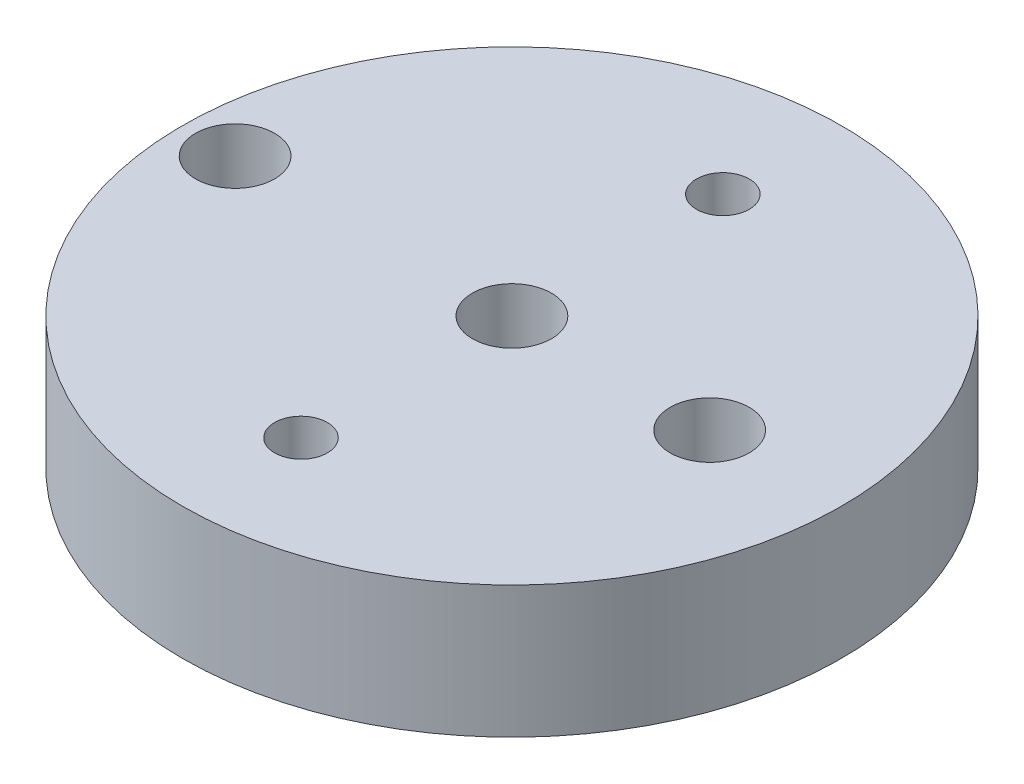
from build123d import *

# Parameters (mm, degrees)
SKETCH1_R           = 12.5
SKETCH1_R_2         = 1
SKETCH1_R_3         = 1.5
BOSS_EXTRUDE1_DEPTH = 5


with BuildPart() as part:
    # Sketch1 → Boss-Extrude1 (new body)
    with BuildSketch(Plane(origin=(0, 0, 0), x_dir=(1, 0, 0), z_dir=(0, 1, 0))):
        with Locations(Location((0, 0, 0), (0, 0, 270))):
            Circle(SKETCH1_R)
        with Locations(Location((0, -8, 0), (0, 0, 270))):
            Circle(SKETCH1_R_2, mode=Mode.SUBTRACT)
        with Locations(Location((0, 8, 0), (0, 0, 270))):
            Circle(SKETCH1_R_2, mode=Mode.SUBTRACT)
        with Locations(Location((0, 0, 0), (0, 0, 270))):
            Circle(SKETCH1_R_3, mode=Mode.SUBTRACT)
        with Locations(Location((-10.5, 0, 0), (0, 0, 270))):
            Circle(SKETCH1_R_3, mode=Mode.SUBTRACT)
        with Locations(Location((7.5, 0, 0), (0, 0, 270))):
            Circle(SKETCH1_R_3, mode=Mode.SUBTRACT)
    extrude(amount=BOSS_EXTRUDE1_DEPTH)


solid = part.part
